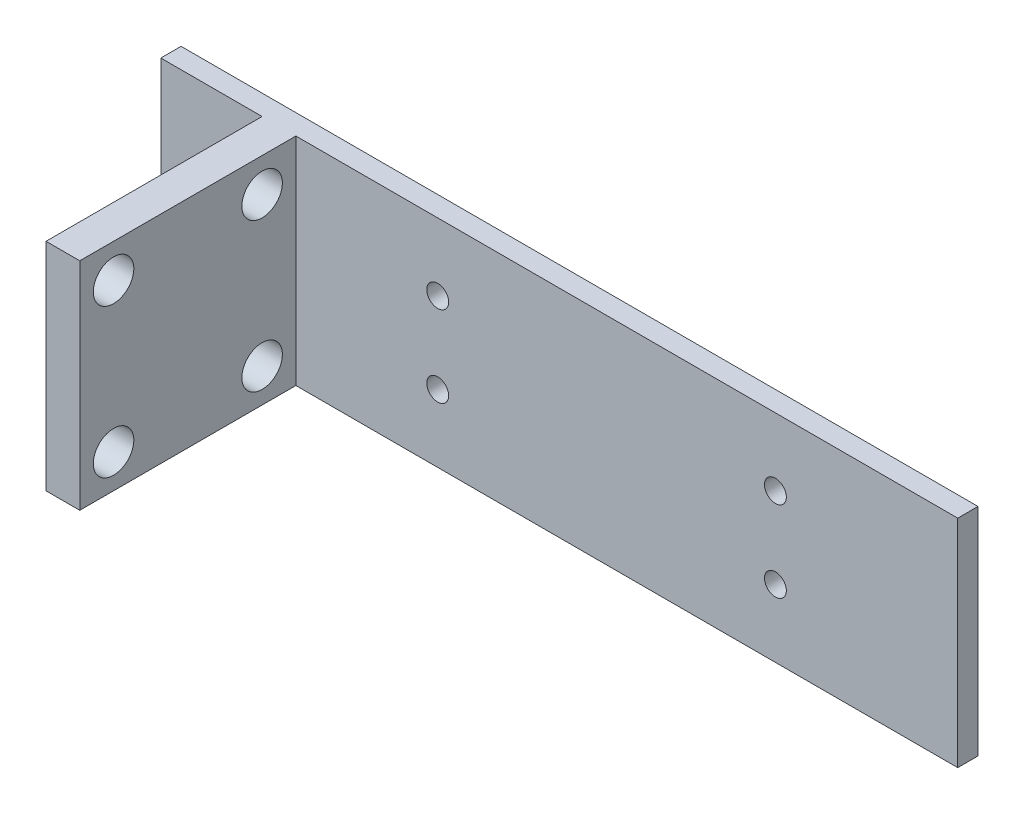
from build123d import *

# Parameters (mm, degrees)
SKETCH_1_W          = 118
SKETCH_1_H          = 32
EXTRUDE_1_DEPTH     = 3
SKETCH_2_R          = 1.62
CUT_EXTRUDE_1_DEPTH = 3
SKETCH_3_W          = 5
SKETCH_3_H          = 32
EXTRUDE_2_DEPTH     = 32
SKETCH_4_R          = 3
CUT_EXTRUDE_2_DEPTH = 32


with BuildPart() as part:
    # 草图1 → 凸台-拉伸1 (new body)
    with BuildSketch(Plane.XY):
        with Locations((-12.281632653, 6.717006803)):
            Rectangle(SKETCH_1_W, SKETCH_1_H)
    extrude(amount=EXTRUDE_1_DEPTH)

    # 草图2 → 切除-拉伸1 (cut)
    with BuildSketch(Plane.XY.offset(3)):
        with Locations((-30.281632653, 12.717006803)):
            Circle(SKETCH_2_R)
        with Locations((-30.281632653, 0.717006803)):
            Circle(SKETCH_2_R)
        with Locations((19.718367347, 12.717006803)):
            Circle(SKETCH_2_R)
        with Locations((19.718367347, 0.717006803)):
            Circle(SKETCH_2_R)
    extrude(amount=-CUT_EXTRUDE_1_DEPTH, mode=Mode.SUBTRACT)

    # 草图3 → 凸台-拉伸2 (add)
    with BuildSketch(Plane.XY.offset(3)):
        with Locations((-53.781632653, 6.717006803)):
            Rectangle(SKETCH_3_W, SKETCH_3_H)
    extrude(amount=EXTRUDE_2_DEPTH)

    # 草图4 → 切除-拉伸2 (cut)
    with BuildSketch(Plane.ZY.offset(71.281632653)):
        with Locations((30, 17.717006803)):
            Circle(SKETCH_4_R)
        with Locations((30, -4.282993197)):
            Circle(SKETCH_4_R)
        with Locations((8, 17.717006803)):
            Circle(SKETCH_4_R)
        with Locations((8, -4.282993197)):
            Circle(SKETCH_4_R)
    extrude(amount=-CUT_EXTRUDE_2_DEPTH, mode=Mode.SUBTRACT)


solid = part.part
